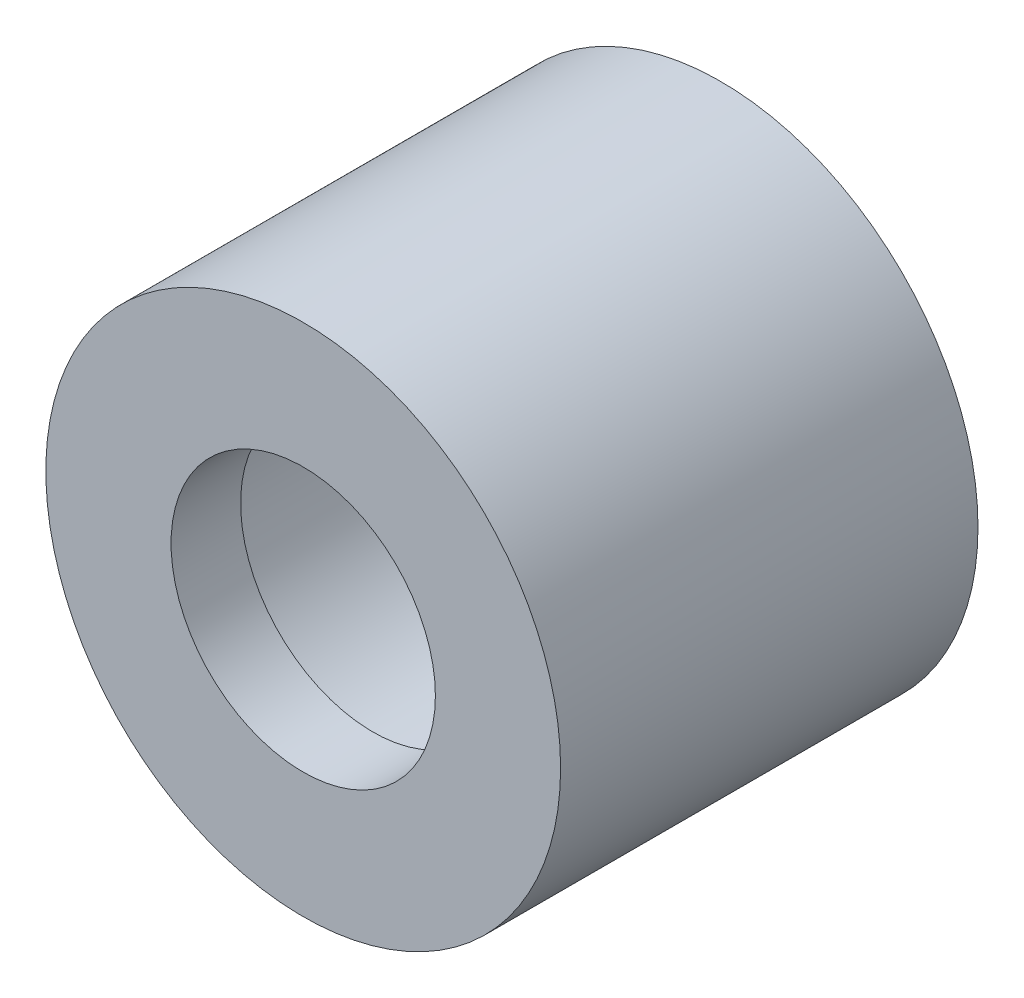
from build123d import *

# Parameters (mm, degrees)
SKETCH1_R           = 23.495
SKETCH1_R_2         = 12.065
BOSS_EXTRUDE1_DEPTH = 38.1
CUT_EXTRUDE1_START  = -31.75
SKETCH2_R           = 15.24
SKETCH2_R_2         = 12.065
CUT_EXTRUDE1_DEPTH  = 31.75
SKETCH4_R           = 2.54
CUT_EXTRUDE5_DEPTH  = 5.08


with BuildPart() as part:
    # Sketch1 → Boss-Extrude1 (new body)
    with BuildSketch(Plane.XY):
        Circle(SKETCH1_R)
        Circle(SKETCH1_R_2, mode=Mode.SUBTRACT)
    extrude(amount=-BOSS_EXTRUDE1_DEPTH)

    # Sketch2 → Cut-Extrude1 (cut)
    with BuildSketch(Plane(origin=(0, 0, -38.1), x_dir=(-1, 0, 0), z_dir=(0, 0, -1)).offset(CUT_EXTRUDE1_START)):
        Circle(SKETCH2_R)
        with Locations(Location((0, 0, 0), (0, 0, 180))):
            Circle(SKETCH2_R_2, mode=Mode.SUBTRACT)
    extrude(amount=CUT_EXTRUDE1_DEPTH, mode=Mode.SUBTRACT)

    # Sketch4 → Cut-Extrude5 (cut)
    with BuildSketch(Plane(origin=(0, 0, -38.1), x_dir=(-1, 0, 0), z_dir=(0, 0, -1))):
        with Locations((0, 19.3675)):
            Circle(SKETCH4_R)
        with Locations((0, -19.3675)):
            Circle(SKETCH4_R)
    extrude(amount=-CUT_EXTRUDE5_DEPTH, mode=Mode.SUBTRACT)


solid = part.part
